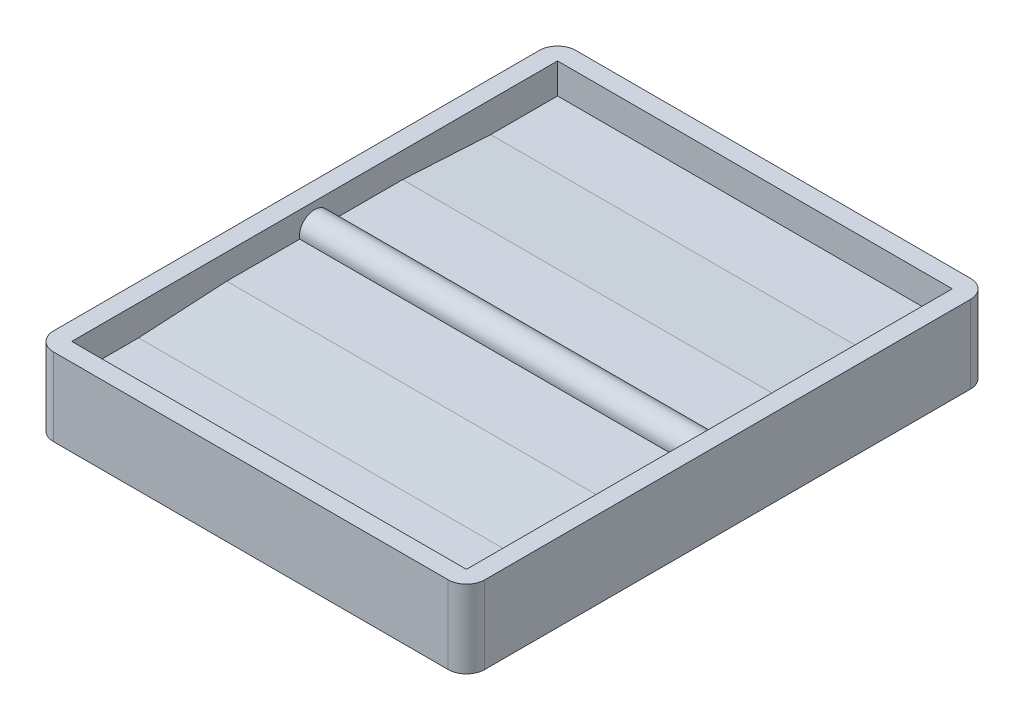
from build123d import *

# Parameters (mm, degrees)
BOSS_EXTRUDE1_DEPTH = 12.8
SKETCH2_W           = 65
SKETCH2_H           = 80
CUT_EXTRUDE1_DEPTH  = 5
SKETCH3_R           = 2.5
BOSS_EXTRUDE2_DEPTH = 65
BOSS_EXTRUDE3_START = 65
BOSS_EXTRUDE3_DEPTH = 65


with BuildPart() as part:
    # Sketch1 → Boss-Extrude1 (new body)
    with BuildSketch(Plane(origin=(0, 0, 0), x_dir=(1, 0, 0), z_dir=(0, 1, 0))):
        with BuildLine():
            Line((-32.5, -43), (32.5, -43))
            ThreePointArc((32.5, -43), (34.621320344, -42.121320344), (35.5, -40))
            Line((35.5, -40), (35.5, 40))
            ThreePointArc((35.5, 40), (34.621320344, 42.121320344), (32.5, 43))
            Line((32.5, 43), (-32.5, 43))
            ThreePointArc((-32.5, 43), (-34.621320344, 42.121320344), (-35.5, 40))
            Line((-35.5, 40), (-35.5, -40))
            ThreePointArc((-35.5, -40), (-34.621320344, -42.121320344), (-32.5, -43))
        make_face()
    extrude(amount=BOSS_EXTRUDE1_DEPTH)

    # Sketch2 → Cut-Extrude1 (cut)
    with BuildSketch(Plane(origin=(0, 12.8, 0), x_dir=(1, 0, 0), z_dir=(0, 1, 0))):
        Rectangle(SKETCH2_W, SKETCH2_H)
    extrude(amount=-CUT_EXTRUDE1_DEPTH, mode=Mode.SUBTRACT)

    # Sketch3 → Boss-Extrude2 (add)
    with BuildSketch(Plane(origin=(-32.5, 0, 0), x_dir=(0, 0, -1), z_dir=(1, 0, 0))):
        with Locations((0, 9.096601027)):
            Circle(SKETCH3_R)
    extrude(amount=BOSS_EXTRUDE2_DEPTH)

    # Sketch4 → Boss-Extrude3 (add)
    with BuildSketch(Plane.ZY.offset(-32.5).offset(BOSS_EXTRUDE3_START)):
        with BuildLine():
            Line((-2.454816759, 8.623447059), (-14.48112221, 8.623447059))
            Line((-14.48112221, 8.623447059), (-28.991763091, 7.8))
            Line((-28.991763091, 7.8), (-2.137481176, 7.8))
            ThreePointArc((-2.137481176, 7.8), (-2.332770101, 8.197610675), (-2.454816759, 8.623447059))
        make_face()
        with BuildLine():
            Line((2.452414649, 8.611150321), (14.48112221, 8.623447059))
            Line((14.48112221, 8.623447059), (28.991763091, 7.8))
            Line((28.991763091, 7.8), (2.137481176, 7.8))
            ThreePointArc((2.137481176, 7.8), (2.330510058, 8.191767966), (2.452414649, 8.611150321))
        make_face()
    extrude(amount=-BOSS_EXTRUDE3_DEPTH)


solid = part.part
